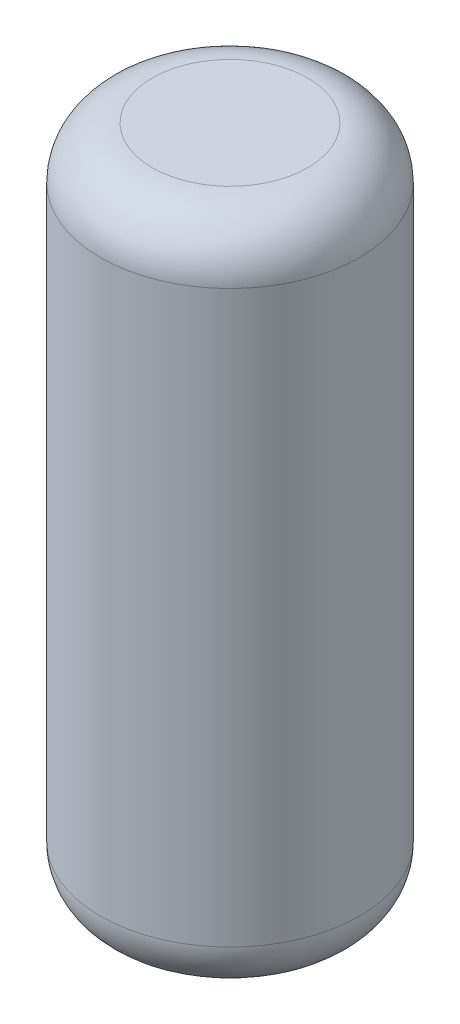
from build123d import *

# Parameters (mm, degrees)
SKETCH1_R           = 2.5
BOSS_EXTRUDE1_DEPTH = 13
FILLET1_R           = 1


with BuildPart() as part:
    # Sketch1 → Boss-Extrude1 (new body)
    with BuildSketch(Plane(origin=(0, 0, 0), x_dir=(1, 0, 0), z_dir=(0, 1, 0))):
        with Locations(Location((0, 0, 0), (0, 0, 90))):
            Circle(SKETCH1_R)
    extrude(amount=BOSS_EXTRUDE1_DEPTH)

    # Fillet1
    fillet1_edges = [part.edges().sort_by_distance(p)[0] for p in [
        (0, 0, 2.5),
        (0, 13, 2.5),
    ]]
    fillet(fillet1_edges, radius=FILLET1_R)


solid = part.part
